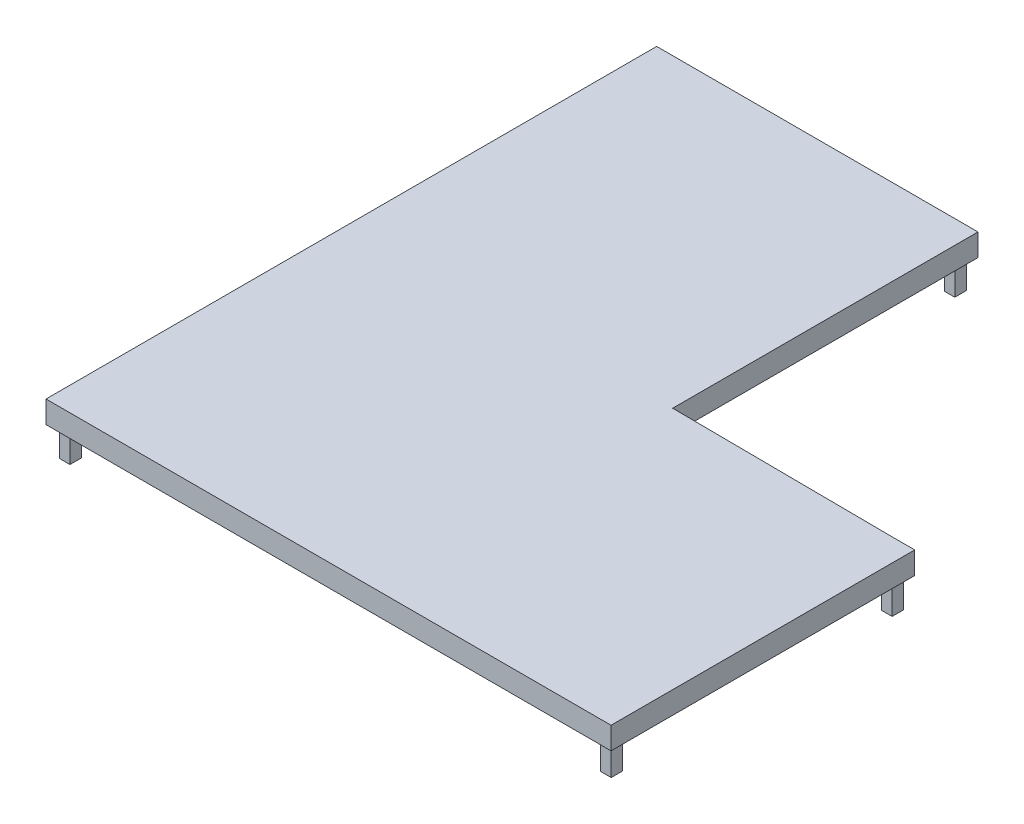
from build123d import *

# Parameters (mm, degrees)
BOSS_EXTRUDE1_DEPTH = 3.81
SKETCH2_W           = 1.806317066
SKETCH2_H           = 1.967276013
SKETCH2_W_2         = 1.806317067
BOSS_EXTRUDE3_DEPTH = 8.8


with BuildPart() as part:
    # Sketch1 → Boss-Extrude1 (new body)
    with BuildSketch(Plane(origin=(0, 0, 0), x_dir=(1, 0, 0), z_dir=(0, 1, 0))):
        Polygon((36.52712799, -14.326641718), (36.52712799, -62.609481683), (-60.401431987, -62.609481683), (-60.401431987, 42.143358282), (-9.091431987, 42.143358282), (-5.281431987, 42.143358282), (-5.281431987, 38.333358282), (-5.281431987, -10.233061701), (32.71712799, -10.516641718), (36.52712799, -10.516641718), align=None)
    extrude(amount=BOSS_EXTRUDE1_DEPTH)

    # Sketch2 → Boss-Extrude3 (add)
    with BuildSketch(Plane(origin=(0, 3.81, 0), x_dir=(1, 0, 0), z_dir=(0, 1, 0))):
        with Locations((34.771422609, -12.560052875)):
            Rectangle(SKETCH2_W, SKETCH2_H)
        with Locations((-7.268072139, 40.235776176)):
            Rectangle(SKETCH2_W_2, SKETCH2_H)
        with Locations((-58.508052472, 39.991804454)):
            Rectangle(SKETCH2_W_2, SKETCH2_H)
        with Locations((-58.311142754, -60.507662725)):
            Rectangle(SKETCH2_W_2, SKETCH2_H)
        with Locations((34.614322263, -60.589626835)):
            Rectangle(SKETCH2_W, SKETCH2_H)
    extrude(amount=-BOSS_EXTRUDE3_DEPTH)


solid = part.part
